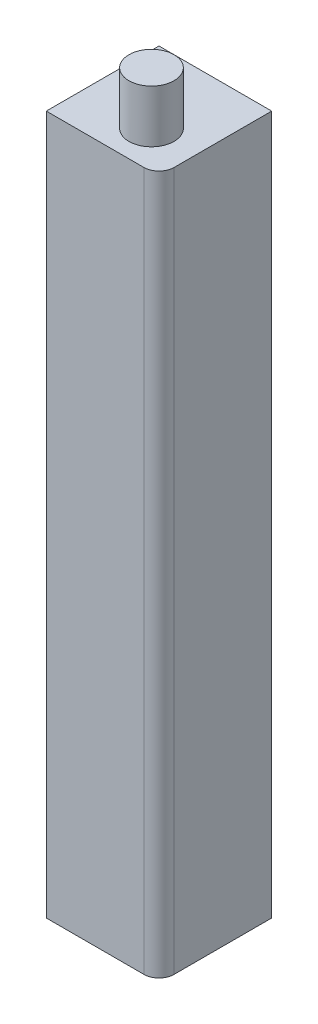
from build123d import *

# Parameters (mm, degrees)
SKETCH1_W           = 15
SKETCH1_H           = 15
BOSS_EXTRUDE1_DEPTH = 93
SKETCH2_R           = 3
BOSS_EXTRUDE2_DEPTH = 7
FILLET1_R           = 2


with BuildPart() as part:
    # Sketch1 → Boss-Extrude1 (new body)
    with BuildSketch(Plane(origin=(0, 0, 0), x_dir=(1, 0, 0), z_dir=(0, 1, 0))):
        Rectangle(SKETCH1_W, SKETCH1_H)
    extrude(amount=BOSS_EXTRUDE1_DEPTH)

    # Sketch2 → Boss-Extrude2 (add)
    with BuildSketch(Plane(origin=(0, 93, 0), x_dir=(1, 0, 0), z_dir=(0, 1, 0))):
        with Locations(Location((1.5, -2.5, 0), (0, 0, 90))):
            Circle(SKETCH2_R)
    extrude(amount=BOSS_EXTRUDE2_DEPTH)

    # Fillet1
    fillet1_edges = [part.edges().sort_by_distance(p)[0] for p in [
        (7.5, 46.5, 7.5),
    ]]
    fillet(fillet1_edges, radius=FILLET1_R)


solid = part.part
